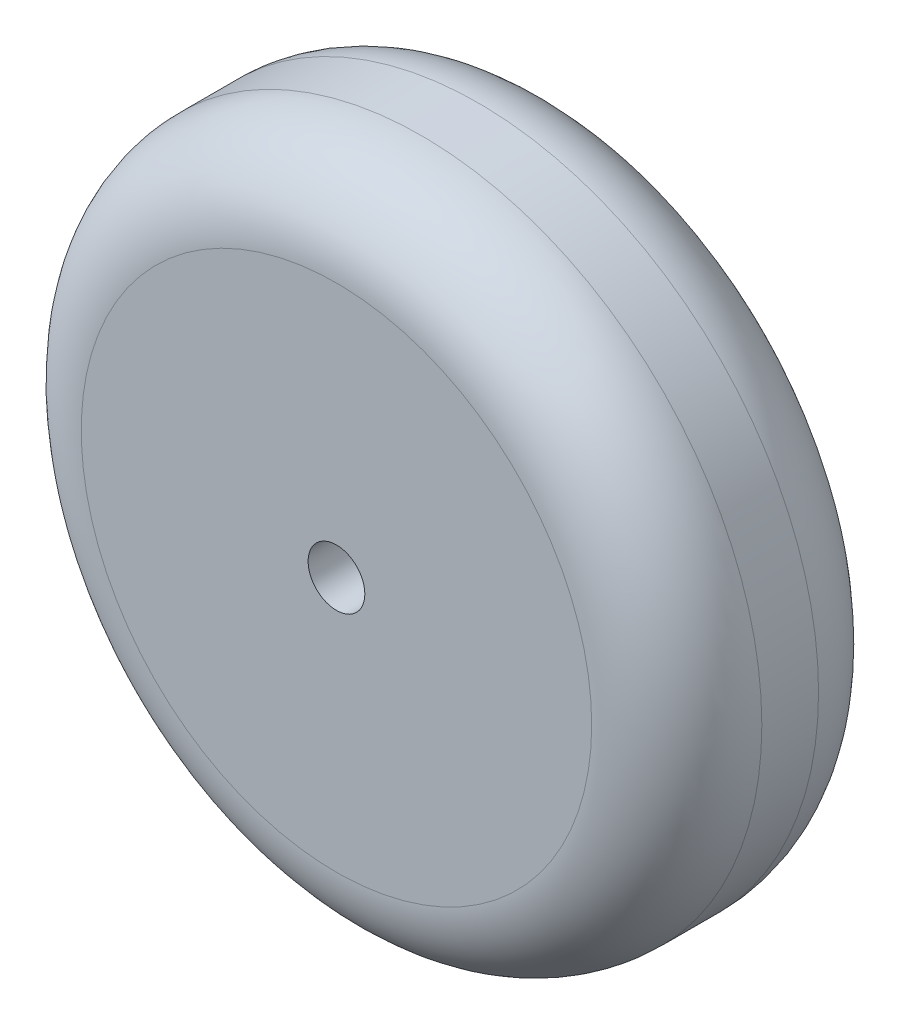
from build123d import *

# Parameters (mm, degrees)
SKETCH1_R           = 30
BOSS_EXTRUDE1_DEPTH = 20
SKETCH2_R           = 2.5
CUT_EXTRUDE1_DEPTH  = 20
FILLET1_R           = 7.5


with BuildPart() as part:
    # Sketch1 → Boss-Extrude1 (new body)
    with BuildSketch(Plane.XY):
        Circle(SKETCH1_R)
    extrude(amount=BOSS_EXTRUDE1_DEPTH)

    # Sketch2 → Cut-Extrude1 (cut)
    with BuildSketch(Plane.XY.offset(20)):
        Circle(SKETCH2_R)
    extrude(amount=-CUT_EXTRUDE1_DEPTH, mode=Mode.SUBTRACT)

    # Fillet1
    fillet1_edges = [part.edges().sort_by_distance(p)[0] for p in [
        (-30, 0, 0),
        (-30, 0, 20),
    ]]
    fillet(fillet1_edges, radius=FILLET1_R)


solid = part.part
